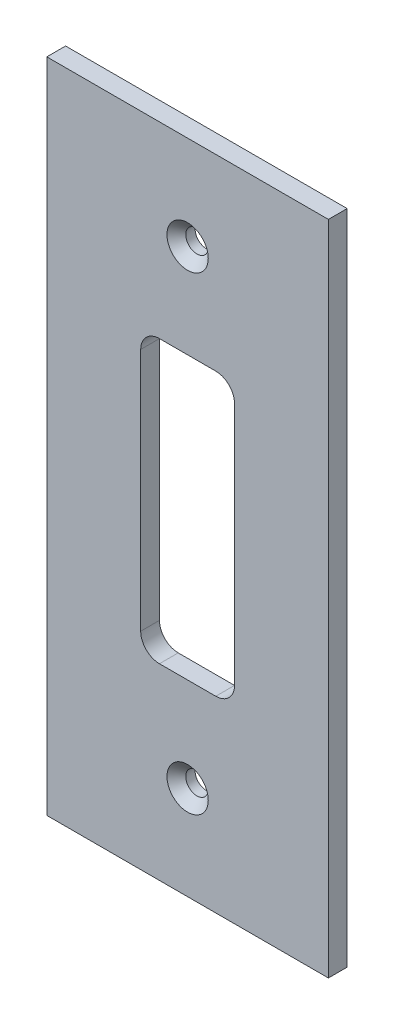
from build123d import *

# Parameters (mm, degrees)
SKETCH1_W                                   = 30
SKETCH1_H                                   = 70
EXTRUDE1_DEPTH                              = 2
CSK_FOR_FLAT_HEAD_MACHINE_SCREW1_AT_2_COUNT = 2
CSK_FOR_FLAT_HEAD_MACHINE_SCREW1_AT_2_PITCH = 50


with BuildPart() as part:
    # Sketch1 → Extrude1 (new body)
    with BuildSketch(Plane.XY):
        with Locations((15, 35)):
            Rectangle(SKETCH1_W, SKETCH1_H)
        with BuildLine():
            Line((12, 50), (18, 50))
            ThreePointArc((18, 50), (19.414213562, 49.414213562), (20, 48))
            Line((20, 48), (20, 22))
            ThreePointArc((20, 22), (19.414213562, 20.585786438), (18, 20))
            Line((18, 20), (12, 20))
            ThreePointArc((12, 20), (10.585786438, 20.585786438), (10, 22))
            Line((10, 22), (10, 48))
            ThreePointArc((10, 48), (10.585786438, 49.414213562), (12, 50))
        make_face(mode=Mode.SUBTRACT)
    extrude(amount=-EXTRUDE1_DEPTH)

    # Sketch2 → CSK for  Flat Head Machine Screw1 (revolve, cut)
    with BuildSketch(Plane(origin=(15, 60, 0), x_dir=(0, -1, 0), z_dir=(1, 0, 0))):
        Polygon((0, 0), (0, 2), (1.2, 2), (1.2, 1), (2.2, 0), align=None)
    csk_for_flat_head_machine_screw1 = revolve(axis=Axis((15, 60, 6.35), (0, 0, -1)), mode=Mode.SUBTRACT)

    # CSK for  Flat Head Machine Screw1 at 2: CSK for  Flat Head Machine Screw1 ×2
    with Locations(*[(0, -i * CSK_FOR_FLAT_HEAD_MACHINE_SCREW1_AT_2_PITCH, 0) for i in range(1, CSK_FOR_FLAT_HEAD_MACHINE_SCREW1_AT_2_COUNT)]):
        add(csk_for_flat_head_machine_screw1, mode=Mode.SUBTRACT)


solid = part.part
